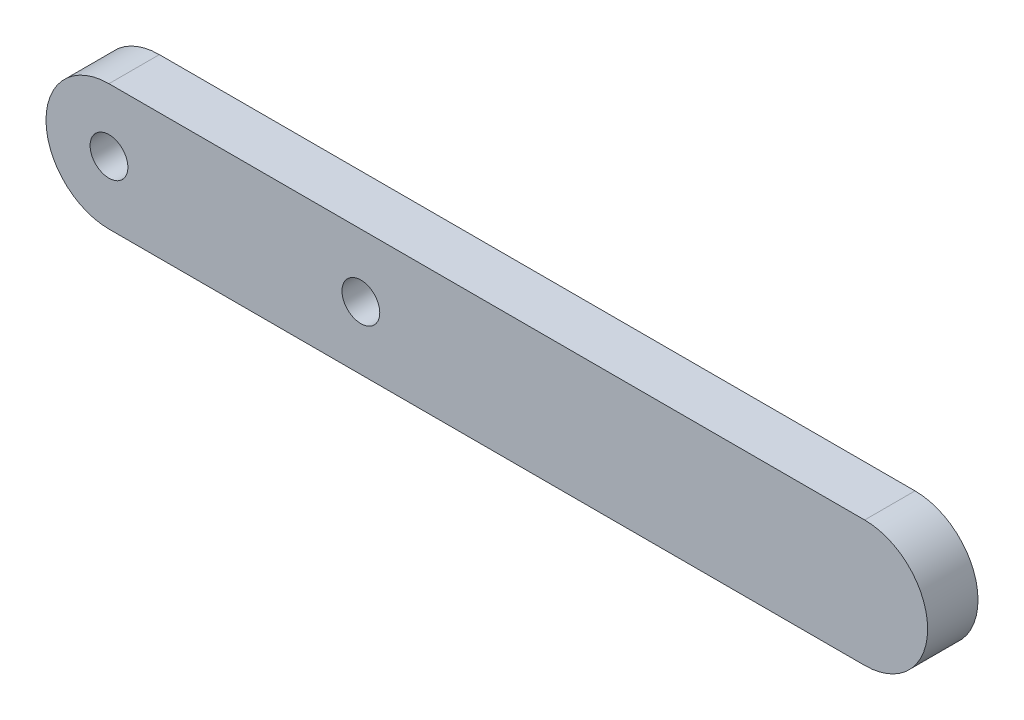
from build123d import *

# Parameters (mm, degrees)
ESQUISSE1_R        = 1.5
BOSS_EXTRU_1_DEPTH = 4


with BuildPart() as part:
    # Esquisse1 → Boss.-Extru.1 (new body)
    with BuildSketch(Plane.XY):
        with BuildLine():
            Line((-30, 5), (30, 5))
            ThreePointArc((30, 5), (35, 0), (30, -5))
            Line((30, -5), (-30, -5))
            ThreePointArc((-30, -5), (-35, 0), (-30, 5))
        make_face()
        with Locations((-30, 0)):
            Circle(ESQUISSE1_R, mode=Mode.SUBTRACT)
        with Locations((-10, 0)):
            Circle(ESQUISSE1_R, mode=Mode.SUBTRACT)
    extrude(amount=BOSS_EXTRU_1_DEPTH)


solid = part.part
